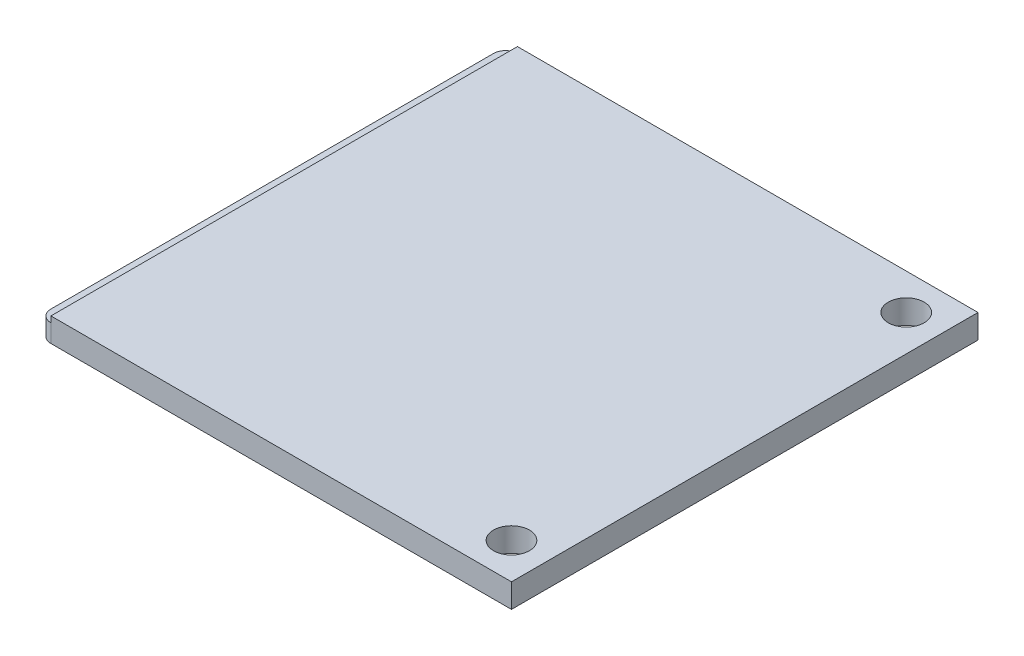
from build123d import *

# Parameters (mm, degrees)
SKIZZE1_W                       = 39.5
SKIZZE1_H                       = 39
AUFSATZ_LINEAR_AUSTRAGEN1_DEPTH = 2
F_3_0_3_DURCHMESSER_BOHRUNG1_D  = 3
SKIZZE4_W                       = 1
SKIZZE4_H                       = 39
SCHNITT_LINEAR_AUSTRAGEN1_DEPTH = 0.5
VERRUNDUNG1_R                   = 1


with BuildPart() as part:
    # Skizze1 → Aufsatz-Linear austragen1 (new body)
    with BuildSketch(Plane(origin=(0, 0, 0), x_dir=(1, 0, 0), z_dir=(0, 1, 0))):
        with Locations((19.75, -19.5)):
            Rectangle(SKIZZE1_W, SKIZZE1_H)
    extrude(amount=AUFSATZ_LINEAR_AUSTRAGEN1_DEPTH)

    # Ø3.0 (3) Durchmesser Bohrung1 (through all)
    with Locations(Plane(origin=(0, 2, 0), x_dir=(1, 0, 0), z_dir=(0, 1, 0))):
        with Locations((36.5, -3), (36.5, -36)):
            Hole(F_3_0_3_DURCHMESSER_BOHRUNG1_D / 2)

    # Skizze4 → Schnitt-Linear austragen1 (cut)
    with BuildSketch(Plane(origin=(0, 2, 0), x_dir=(1, 0, 0), z_dir=(0, 1, 0))):
        with Locations((0.5, -19.5)):
            Rectangle(SKIZZE4_W, SKIZZE4_H)
    extrude(amount=-SCHNITT_LINEAR_AUSTRAGEN1_DEPTH, mode=Mode.SUBTRACT)

    # Verrundung1
    verrundung1_edges = [part.edges().sort_by_distance(p)[0] for p in [
        (0, 0.75, 0),
        (0, 0.75, 39),
    ]]
    fillet(verrundung1_edges, radius=VERRUNDUNG1_R)


solid = part.part
